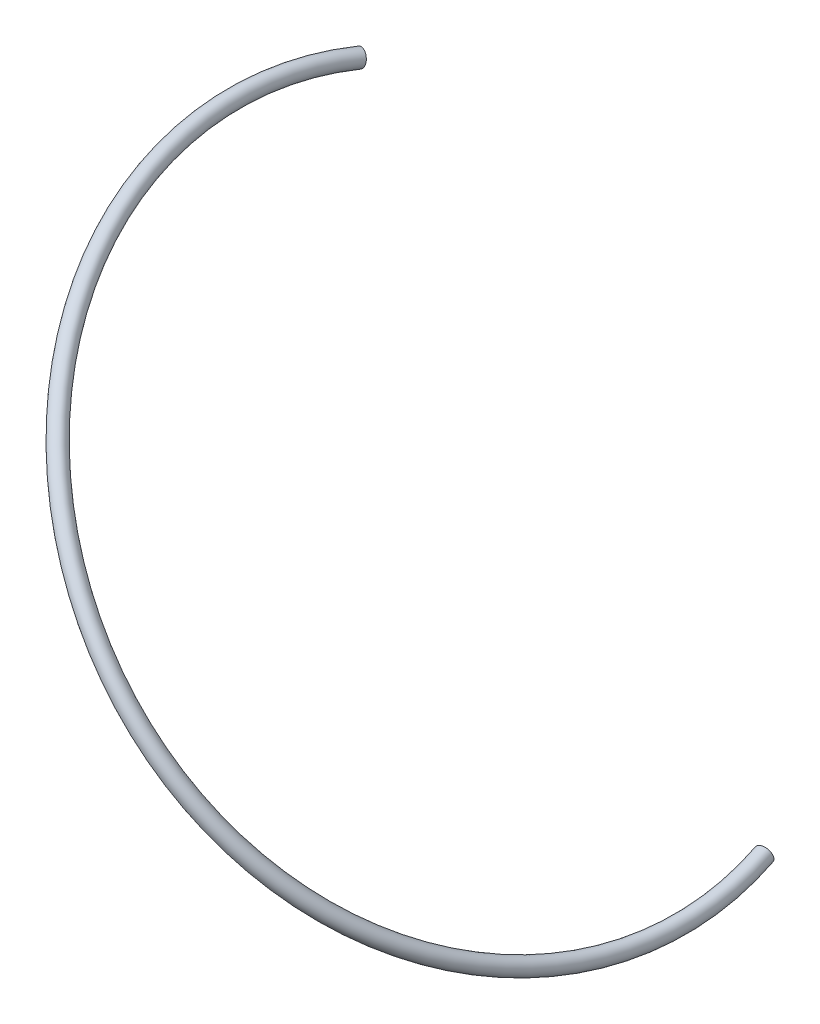
from build123d import *

# Parameters (mm, degrees)
SWEEP1_PROFILE_R = 2


with BuildPart() as part:
    # Sweep1: sweep along a path in Sketch2
    with BuildLine(Plane(origin=(88.428334222, 80.054585782, 0), x_dir=(0, 0, 1), z_dir=(-0.741335556230142, -0.6711345566046694, 0))) as sweep1_path:
        ThreePointArc((22.25, -73.117477405), (130.389016376, -146.773948479), (27, -226.961440562))
    # Sweep1 profile (on start of the path) → Sweep1 (sweep)
    with BuildSketch(Plane(origin=(137.5, 25.85, 22.25), x_dir=(0, 0.9664889622399796, -0.25670817257790507), z_dir=(-0.22636654096536785, 0.25004459077094504, 0.9414010260019717))):
        Circle(SWEEP1_PROFILE_R)
    sweep(path=sweep1_path.line)


solid = part.part
